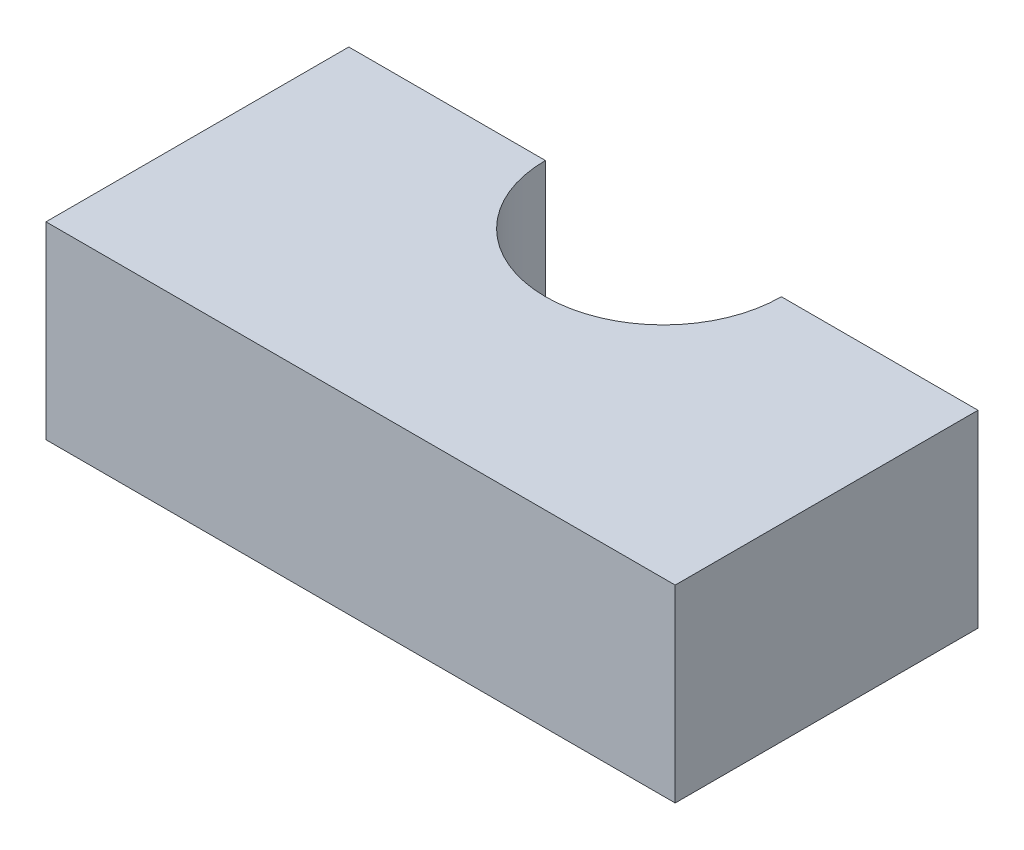
from build123d import *

# Parameters (mm, degrees)
SKETCH1_W           = 1.6
SKETCH1_H           = 0.77
BOSS_EXTRUDE1_DEPTH = 0.48
SKETCH2_R           = 0.3
CUT_EXTRUDE1_DEPTH  = 2.009269538


with BuildPart() as part:
    # Sketch1 → Boss-Extrude1 (new body)
    with BuildSketch(Plane(origin=(0, 0, 0), x_dir=(1, 0, 0), z_dir=(0, 1, 0))):
        Rectangle(SKETCH1_W, SKETCH1_H)
    extrude(amount=BOSS_EXTRUDE1_DEPTH)

    # Sketch2 → Cut-Extrude1 (cut, through all)
    with BuildSketch(Plane(origin=(0, 0.48, 0), x_dir=(1, 0, 0), z_dir=(0, 1, 0))):
        with Locations((0, 0.385)):
            Circle(SKETCH2_R)
    extrude(amount=-CUT_EXTRUDE1_DEPTH, mode=Mode.SUBTRACT)


solid = part.part
